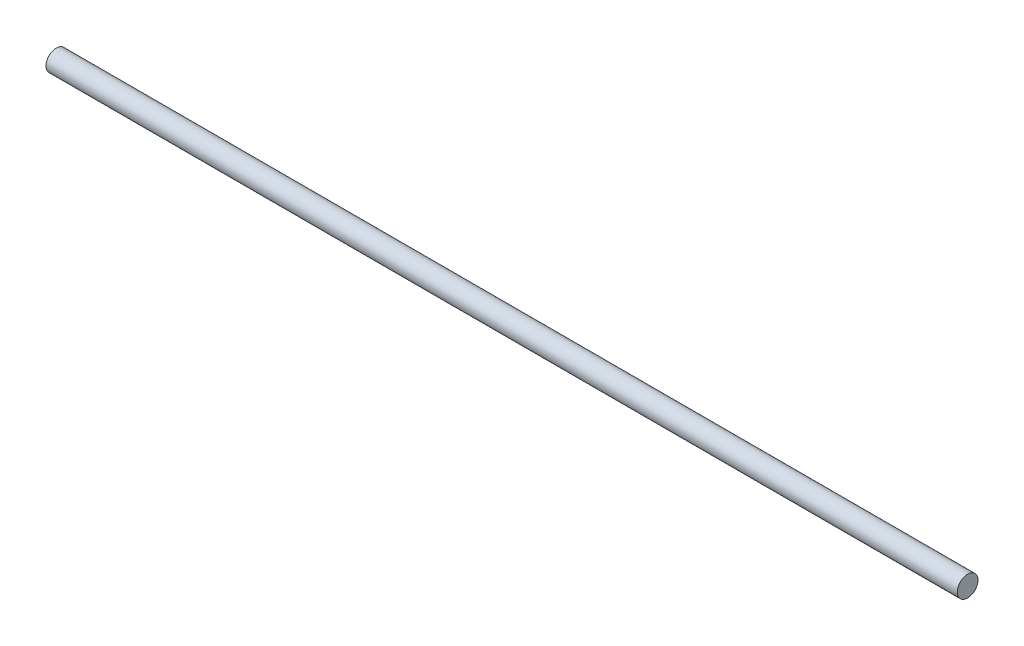
from build123d import *

# Parameters (mm, degrees)
SKETCH3_R           = 5
BOSS_EXTRUDE1_DEPTH = 440


with BuildPart() as part:
    # Sketch3 → Boss-Extrude1 (new body)
    with BuildSketch(Plane(origin=(0, 0, 0), x_dir=(0, 0, -1), z_dir=(1, 0, 0))):
        with Locations((-0.358321314, 0.248258056)):
            Circle(SKETCH3_R)
    extrude(amount=BOSS_EXTRUDE1_DEPTH)


solid = part.part
